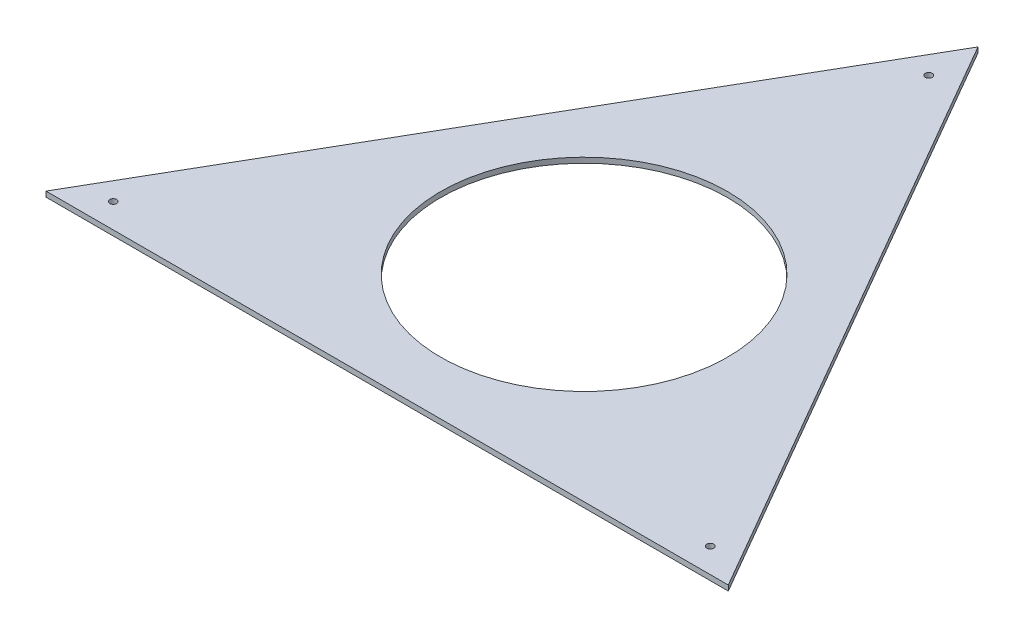
from build123d import *

# Parameters (mm, degrees)
BOSS_EXTRUDE1_DEPTH     = 4.7625
CUT_EXTRUDE3_DEPTH      = 4.7625
CUT_EXTRUDE3_DEPTH_BACK = 4.7625
SKETCH5_R               = 129.54
SKETCH6_R               = 3.175
CUT_EXTRUDE5_DEPTH      = 4.7625


with BuildPart() as part:
    # Sketch1 → Boss-Extrude1 (new body)
    with BuildSketch(Plane(origin=(0, 0, 0), x_dir=(1, 0, 0), z_dir=(0, 1, 0))):
        Polygon((0, 355.6), (-307.958633586, -177.8), (307.958633586, -177.8), align=None)
    extrude(amount=BOSS_EXTRUDE1_DEPTH)

    # Sketch5 → Cut-Extrude3 (cut, two sides: drawn at the far end of the back side and taken through both)
    with BuildSketch(Plane(origin=(0, 0, 0), x_dir=(1, 0, 0), z_dir=(0, 1, 0)).offset(-CUT_EXTRUDE3_DEPTH_BACK)):
        Circle(SKETCH5_R)
    extrude(amount=CUT_EXTRUDE3_DEPTH + CUT_EXTRUDE3_DEPTH_BACK, mode=Mode.SUBTRACT)

    # Sketch6 → Cut-Extrude5 (cut)
    with BuildSketch(Plane(origin=(0, 0, 0), x_dir=(1, 0, 0), z_dir=(0, 1, 0))):
        with Locations((-269.463804388, -155.575)):
            Circle(SKETCH6_R)
        with Locations((0, 311.15)):
            Circle(SKETCH6_R)
    cut_extrude5 = extrude(amount=CUT_EXTRUDE5_DEPTH, mode=Mode.SUBTRACT)

    # Mirror1: Cut-Extrude5 across plane
    add(cut_extrude5.mirror(Plane(origin=(0, 0, 0), x_dir=(0, 0, 1), z_dir=(1, 0, 0))), mode=Mode.SUBTRACT)


solid = part.part
